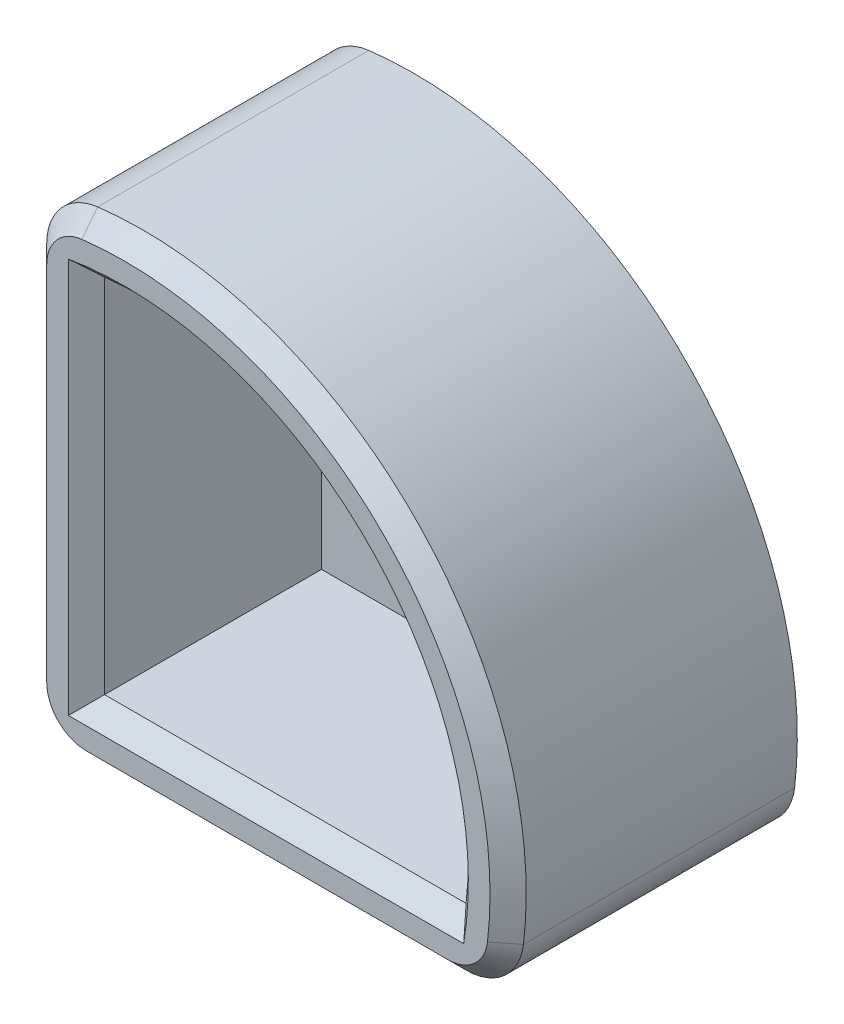
from build123d import *

# Parameters (mm, degrees)
EXTRUDE_1_DEPTH     = 8
CUT_EXTRUDE_1_DEPTH = 6.5
CUT_EXTRUDE_2_DEPTH = 18.728535031
FILLET_1_R          = 1.6
CHAMFER_2_SIZE      = 0.5


with BuildPart() as part:
    # 草图1 → 凸台-拉伸1 (new body)
    with BuildSketch(Plane.XY):
        with BuildLine():
            Line((-1.6, -1.6), (11.323037582, -1.6))
            ThreePointArc((11.323037582, -1.6), (8.558327944, 8.558327944), (-1.6, 11.323037582))
            Line((-1.6, 11.323037582), (-1.6, -1.6))
        make_face()
    extrude(amount=EXTRUDE_1_DEPTH)

    # 草图2 → 切除-拉伸1 (cut)
    with BuildSketch(Plane.XY.offset(8)):
        with BuildLine():
            Line((0, 0), (10, 0))
            ThreePointArc((10, 0), (7.426957094, 7.426957094), (0, 10))
            Line((0, 10), (0, 0))
        make_face()
    extrude(amount=-CUT_EXTRUDE_1_DEPTH, mode=Mode.SUBTRACT)

    # 草图5 → 切除-拉伸2 (cut, through all)
    with BuildSketch(Plane.XY.offset(1.5)):
        with BuildLine():
            Line((2.616116524, 4.616116524), (4.616116524, 2.616116524))
            ThreePointArc((4.616116524, 2.616116524), (6.383883476, 2.616116524), (6.383883476, 4.383883476))
            Line((6.383883476, 4.383883476), (4.383883476, 6.383883476))
            ThreePointArc((4.383883476, 6.383883476), (2.616116524, 6.383883476), (2.616116524, 4.616116524))
        make_face()
    extrude(amount=-CUT_EXTRUDE_2_DEPTH, mode=Mode.SUBTRACT)

    # 圆角1
    fillet_1_edges = [part.edges().sort_by_distance(p)[0] for p in [
        (-1.6, 11.323037582, 4),
        (11.323037582, -1.6, 4),
        (-1.6, -1.6, 4),
    ]]
    fillet(fillet_1_edges, radius=FILLET_1_R)

    # 倒角2
    chamfer_2_edges = [part.edges().sort_by_distance(p)[0] for p in [
        (0, 5, 8),
        (5, 0, 8),
        (7.426957094, 7.426957094, 8),
        (-1.6, 5, 8),
        (8.558327944, 8.558327944, 8),
        (5, -1.6, 8),
        (11.062458629, -1.19632005, 8),
        (-1.13137085, -1.13137085, 8),
        (-1.19632005, 11.062458629, 8),
    ]]
    chamfer(chamfer_2_edges, length=CHAMFER_2_SIZE)


solid = part.part
